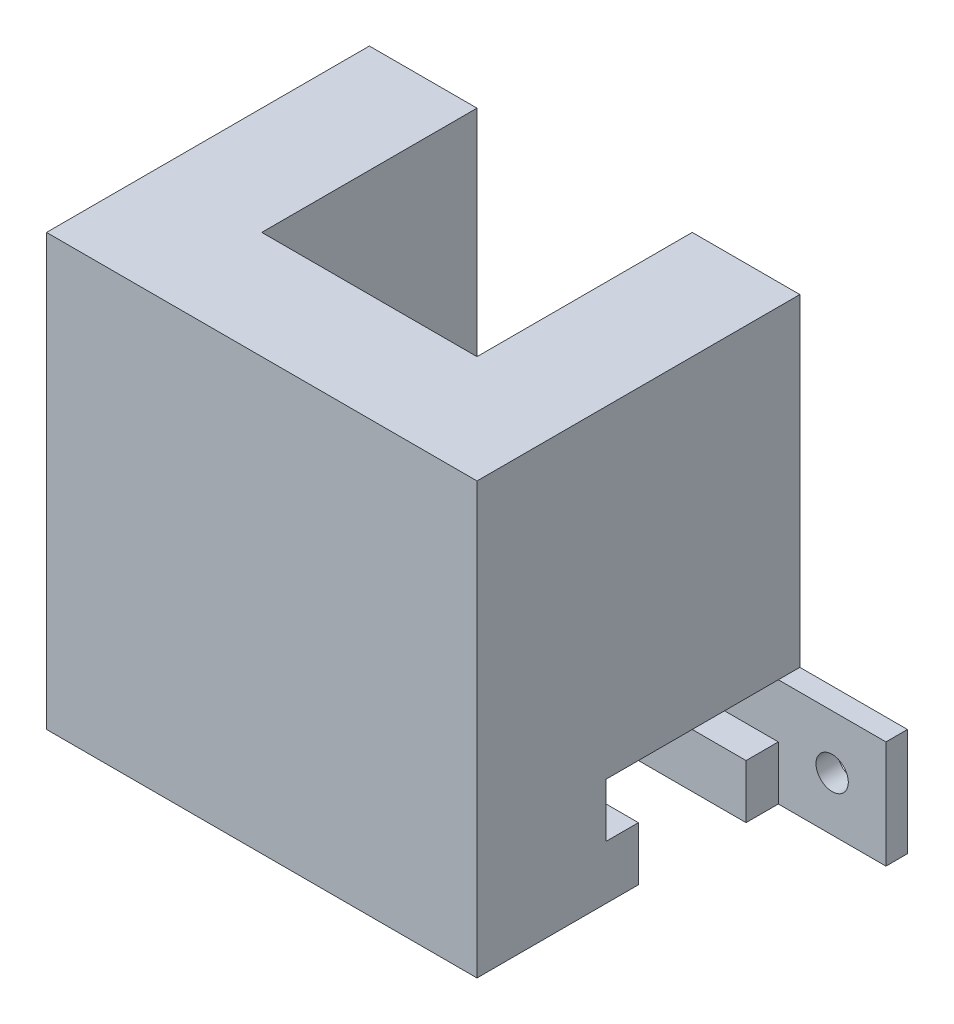
from build123d import *

# Parameters (mm, degrees)
SKETCH1_W           = 40
SKETCH1_H           = 40
BOSS_EXTRUDE1_DEPTH = 30
SKETCH2_W           = 20
SKETCH2_H           = 20
CUT_EXTRUDE1_DEPTH  = 20
SKETCH5_R           = 1.8
CUT_EXTRUDE6_DEPTH  = 20
SKETCH25_W          = 2
SKETCH25_H          = 10
BOSS_EXTRUDE2_DEPTH = 10
SKETCH26_W          = 2
SKETCH26_H          = 10
BOSS_EXTRUDE3_DEPTH = 10
SKETCH27_R          = 1.5
CUT_EXTRUDE7_DEPTH  = 10
CUT_EXTRUDE8_DEPTH  = 10
CUT_EXTRUDE9_DEPTH  = 10
SKETCH30_R          = 3
CUT_EXTRUDE10_DEPTH = 5


with BuildPart() as part:
    # Sketch1 → Boss-Extrude1 (new body)
    with BuildSketch(Plane.XY):
        with Locations((-5.074257426, 5)):
            Rectangle(SKETCH1_W, SKETCH1_H)
    extrude(amount=BOSS_EXTRUDE1_DEPTH)

    # Sketch2 → Cut-Extrude1 (cut)
    with BuildSketch(Plane(origin=(0, 0, 0), x_dir=(-1, 0, 0), z_dir=(0, 0, -1))):
        with Locations((5.074257426, 15)):
            Rectangle(SKETCH2_W, SKETCH2_H)
    extrude(amount=-CUT_EXTRUDE1_DEPTH, mode=Mode.SUBTRACT)

    # Sketch5 → Cut-Extrude6 (cut)
    with BuildSketch(Plane(origin=(0, 5, 0), x_dir=(1, 0, 0), z_dir=(0, 1, 0))):
        with Locations(Location((-5.074257426, -10, 0), (0, 0, 270))):
            Circle(SKETCH5_R)
    extrude(amount=-CUT_EXTRUDE6_DEPTH, mode=Mode.SUBTRACT)

    # Sketch24 → Cut-Revolve1 (revolve, cut)
    with BuildSketch(Plane.XY.offset(10), mode=Mode.PRIVATE) as cut_revolve1_sk:
        Polygon((-3.274257426, -5), (-5.074257426, -5), (-5.074257426, 5), (4.925742574, 5), align=None)
    revolve(cut_revolve1_sk.sketch.rotate(Axis((-5.074257426, 5, 10), (0, -1, 0)), 90), axis=Axis((-5.074257426, 5, 10), (0, -1, 0)), mode=Mode.SUBTRACT)

    # Sketch25 → Boss-Extrude2 (add)
    with BuildSketch(Plane.ZY.offset(25.074257426)):
        with Locations((1, -10)):
            Rectangle(SKETCH25_W, SKETCH25_H)
    extrude(amount=BOSS_EXTRUDE2_DEPTH)

    # Sketch26 → Boss-Extrude3 (add)
    with BuildSketch(Plane(origin=(14.925742574, 0, 0), x_dir=(0, 0, -1), z_dir=(1, 0, 0))):
        with Locations((-1, -10)):
            Rectangle(SKETCH26_W, SKETCH26_H)
    extrude(amount=BOSS_EXTRUDE3_DEPTH)

    # Sketch27 → Cut-Extrude7 (cut)
    with BuildSketch(Plane(origin=(0, 0, 0), x_dir=(-1, 0, 0), z_dir=(0, 0, -1))):
        with Locations((-19.925742574, -10)):
            Circle(SKETCH27_R)
        with Locations((30.074257426, -10)):
            Circle(SKETCH27_R)
    extrude(amount=-CUT_EXTRUDE7_DEPTH, mode=Mode.SUBTRACT)

    # Sketch28 → Cut-Extrude8 (cut)
    with BuildSketch(Plane(origin=(14.925742574, 0, 0), x_dir=(0, 0, -1), z_dir=(1, 0, 0))):
        Polygon((-15, -10), (-15, -15), (-5, -15), (-5, -10), (-2, -10), (-2, -5), (-18, -5), (-18, -10), align=None)
    extrude(amount=-CUT_EXTRUDE8_DEPTH, mode=Mode.SUBTRACT)

    # Sketch29 → Cut-Extrude9 (cut)
    with BuildSketch(Plane.ZY.offset(25.074257426)):
        Polygon((5, -15), (15, -15), (15, -10), (18, -10), (18, -5), (2, -5), (2, -10), (5, -10), align=None)
    extrude(amount=-CUT_EXTRUDE9_DEPTH, mode=Mode.SUBTRACT)

    # Sketch30 → Cut-Extrude10 (cut)
    with BuildSketch(Plane.XZ.offset(15)):
        with Locations(Location((-5.074257426, 10, 0), (0, 0, 270))):
            Circle(SKETCH30_R)
    extrude(amount=-CUT_EXTRUDE10_DEPTH, mode=Mode.SUBTRACT)


solid = part.part
